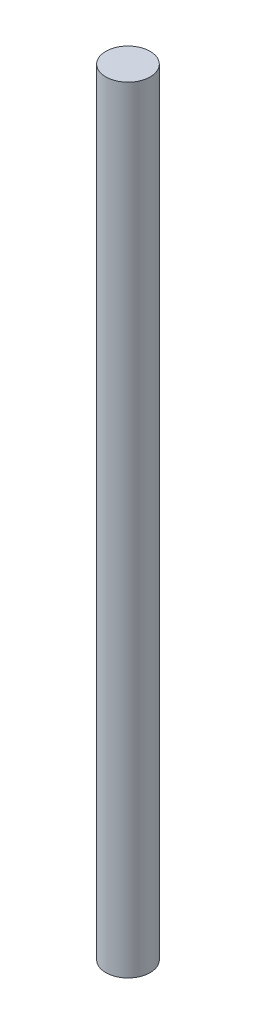
from build123d import *

# Parameters (mm, degrees)
CROQUIS1_R              = 4
SALIENTE_EXTRUIR1_DEPTH = 140


with BuildPart() as part:
    # Croquis1 → Saliente-Extruir1 (new body)
    with BuildSketch(Plane(origin=(0, 0, 0), x_dir=(1, 0, 0), z_dir=(0, 1, 0))):
        with Locations(Location((0, 0, 0), (0, 0, 270))):
            Circle(CROQUIS1_R)
    extrude(amount=SALIENTE_EXTRUIR1_DEPTH)


solid = part.part
